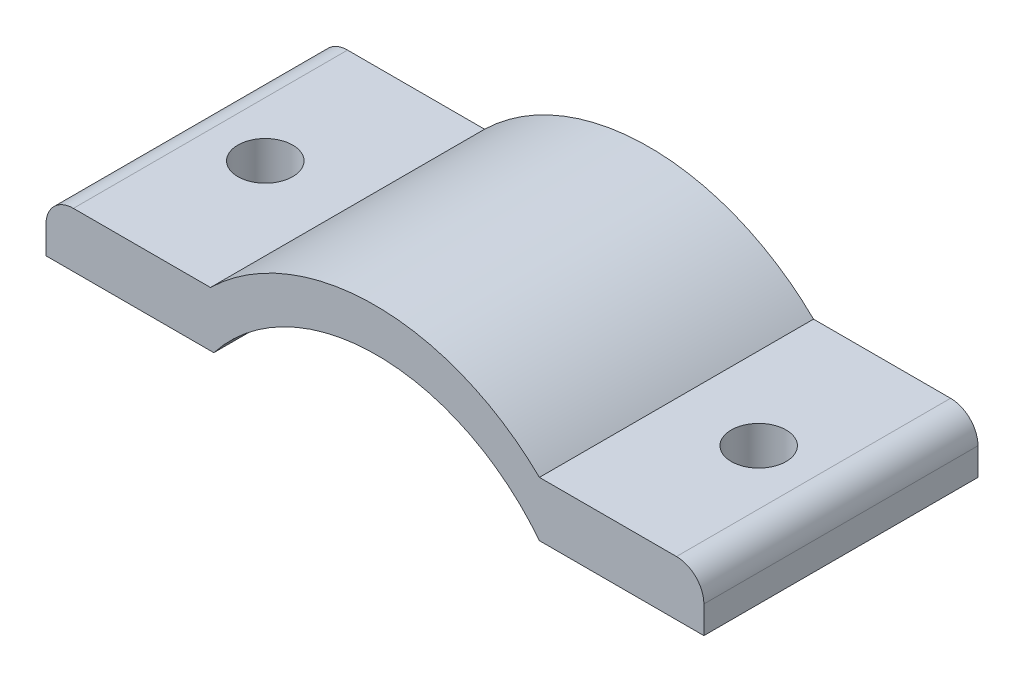
from build123d import *

# Parameters (mm, degrees)
BOSS_EXTRUDE1_DEPTH = 10
SKETCH3_R           = 1
CUT_EXTRUDE1_DEPTH  = 10
FILLET1_R           = 1


with BuildPart() as part:
    # Sketch2 → Boss-Extrude1 (new body)
    with BuildSketch(Plane.XY):
        with BuildLine():
            Line((-19.540356597, 0), (-19.540356597, -2))
            Line((-19.540356597, -2), (-13.418721915, -2))
            ThreePointArc((-13.418721915, -2), (-7.479539256, 0.9), (-1.540356597, -2))
            Line((-1.540356597, -2), (4.459643403, -2))
            Line((4.459643403, -2), (4.459643403, 0))
            Line((4.459643403, 0), (-1.540356597, 0))
            ThreePointArc((-1.540356597, 0), (-7.540356597, 2.439966221), (-13.540356597, 0))
            Line((-13.540356597, 0), (-19.540356597, 0))
        make_face()
    extrude(amount=BOSS_EXTRUDE1_DEPTH)

    # Sketch3 → Cut-Extrude1 (cut)
    with BuildSketch(Plane(origin=(0, 0, 0), x_dir=(1, 0, 0), z_dir=(0, 1, 0))):
        with Locations(Location((-16.540356597, -5, 0), (0, 0, 270))):
            Circle(SKETCH3_R)
        with Locations(Location((1.459643403, -5, 0), (0, 0, 270))):
            Circle(SKETCH3_R)
    extrude(amount=-CUT_EXTRUDE1_DEPTH, mode=Mode.SUBTRACT)

    # Fillet1
    fillet1_edges = [part.edges().sort_by_distance(p)[0] for p in [
        (4.459643403, 0, 5),
        (-19.540356597, 0, 5),
    ]]
    fillet(fillet1_edges, radius=FILLET1_R)


solid = part.part
